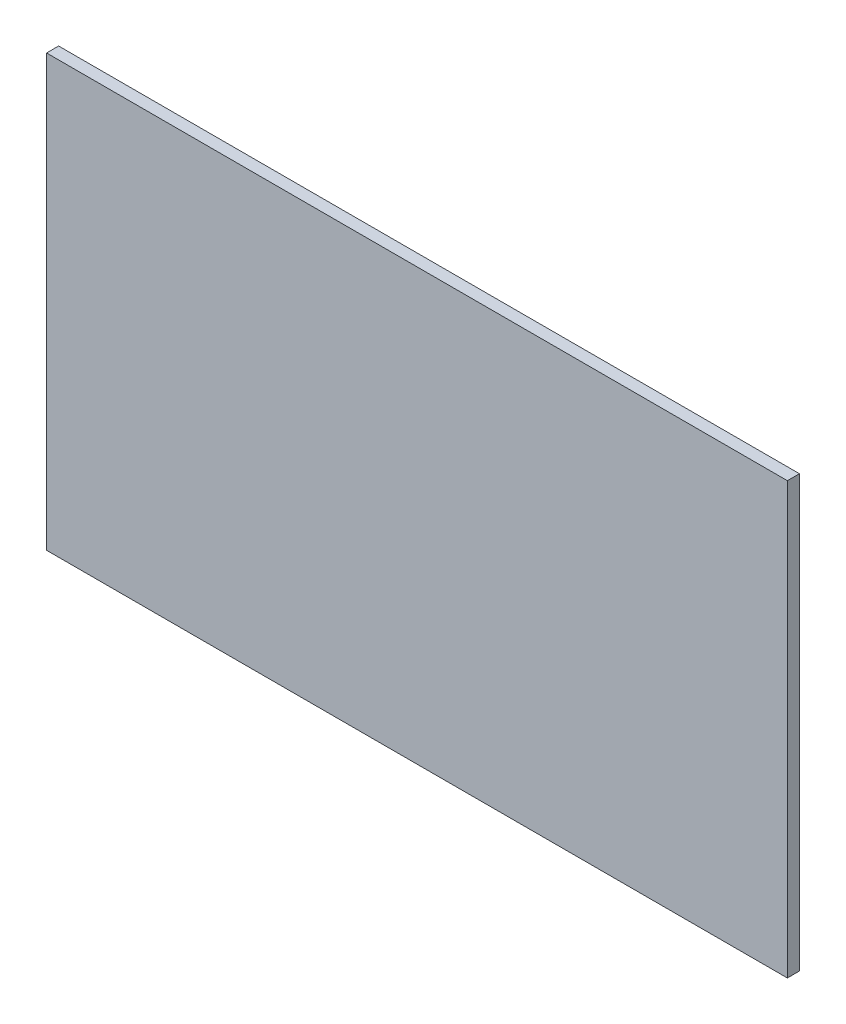
from build123d import *

# Parameters (mm, degrees)
ESQUISSE1_W        = 258
ESQUISSE1_H        = 150
BOSS_EXTRU_1_DEPTH = 4.2


with BuildPart() as part:
    # Esquisse1 → Boss.-Extru.1 (new body)
    with BuildSketch(Plane.XY):
        with Locations((23.528291112, 6.547058824)):
            Rectangle(ESQUISSE1_W, ESQUISSE1_H)
    extrude(amount=BOSS_EXTRU_1_DEPTH)


solid = part.part
